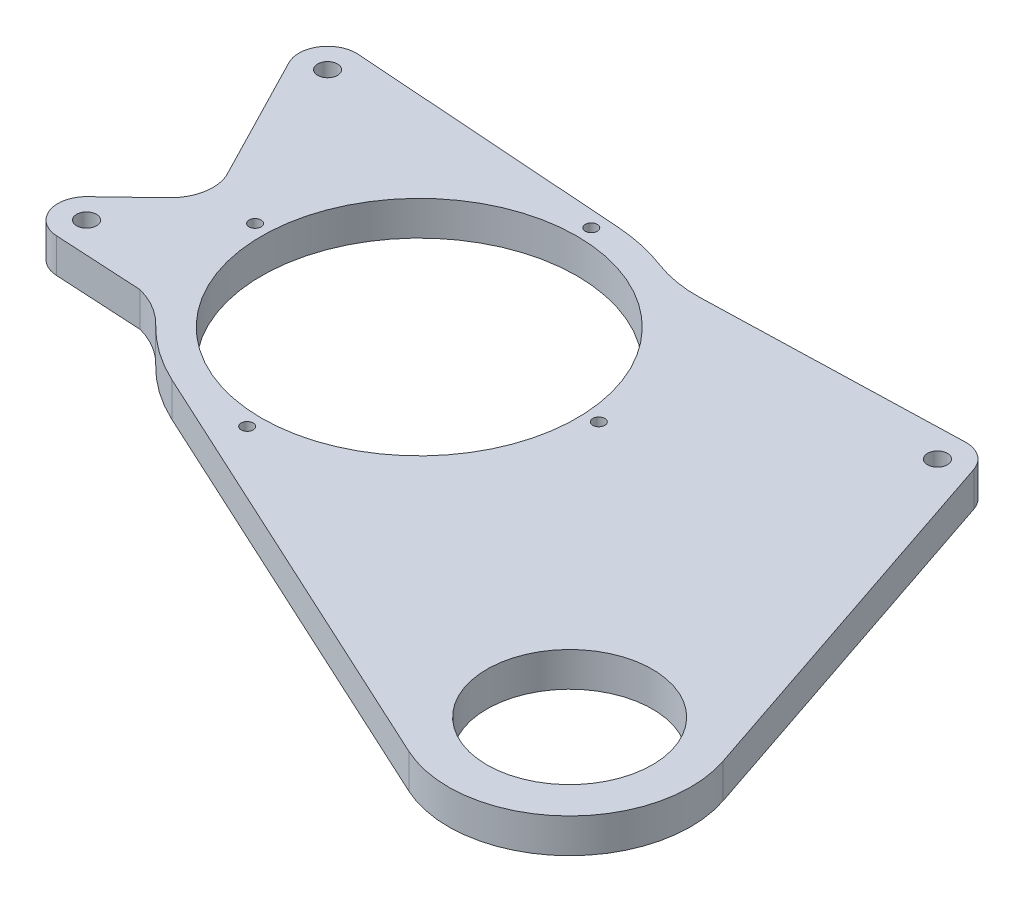
from build123d import *

# Parameters (mm, degrees)
SKETCH1_R           = 3.3
SKETCH1_R_2         = 27.5
SKETCH1_R_3         = 52.3875
SKETCH1_R_4         = 2
BOSS_EXTRUDE1_DEPTH = 11.43


with BuildPart() as part:
    # Sketch1 → Boss-Extrude1 (new body)
    with BuildSketch(Plane(origin=(0, 0, 0), x_dir=(1, 0, 0), z_dir=(0, 1, 0))):
        with BuildLine():
            Line((-455.030211447, -196.569220819), (-601.269315712, -129.028875319))
            ThreePointArc((-601.269315712, -129.028875319), (-611.168375764, -123.292603215), (-619.842929594, -115.832822829))
            ThreePointArc((-619.842929594, -115.832822829), (-625.62049557, -111.271620388), (-632.402453753, -108.409823836))
            Line((-632.402453753, -108.409823836), (-661.891152149, -106.785342117))
            ThreePointArc((-661.891152149, -106.785342117), (-670.303863855, -100.570549133), (-667.940742704, -90.381681261))
            Line((-667.940742704, -90.381681261), (-654.343117313, -77.414452829))
            ThreePointArc((-654.343117313, -77.414452829), (-650.072978561, -70.012815509), (-650.805846426, -61.499224923))
            Line((-650.805846426, -61.499224923), (-673.057822329, -18.34288652))
            ThreePointArc((-673.057822329, -18.34288652), (-672.544957076, -8.73610108), (-663.918846707, -4.476573271))
            Line((-663.918846707, -4.476573271), (-570.934950003, -11.063752399))
            ThreePointArc((-570.934950003, -11.063752399), (-561.986230526, -12.359631359), (-553.321698813, -14.945124108))
            ThreePointArc((-553.321698813, -14.945124108), (-545.349986654, -17.107158275), (-537.109590399, -17.671477372))
            Line((-537.109590399, -17.671477372), (-451.561292182, -15.180486069))
            ThreePointArc((-451.561292182, -15.180486069), (-445.839616936, -16.885847624), (-442.257047488, -21.661936169))
            Line((-442.257047488, -21.661936169), (-399.995822112, -147.172985144))
            ThreePointArc((-399.995822112, -147.172985144), (-411.258692171, -189.980718354), (-455.030211447, -196.569220819))
        make_face()
        with Locations(Location((-661.367230642, -97.274762153, 0), (0, 0, 270))):
            Circle(SKETCH1_R, mode=Mode.SUBTRACT)
        with Locations(Location((-664.591931322, -13.977761728, 0), (0, 0, 270))):
            Circle(SKETCH1_R, mode=Mode.SUBTRACT)
        with Locations(Location((-451.284061184, -24.701450725, 0), (0, 0, 270))):
            Circle(SKETCH1_R, mode=Mode.SUBTRACT)
        with Locations(Location((-438.15, -160.02, 0), (0, 0, 270))):
            Circle(SKETCH1_R_2, mode=Mode.SUBTRACT)
        with Locations(Location((-575.31, -72.821477372, 0), (0, 0, 270))):
            Circle(SKETCH1_R_3, mode=Mode.SUBTRACT)
        with Locations(Location((-632.402453753, -70.257452317, 0), (0, 0, 270))):
            Circle(SKETCH1_R_4, mode=Mode.SUBTRACT)
        with BuildLine():
            ThreePointArc((-575.31, -17.671477372), (-573.31, -15.671477372), (-575.31, -13.671477372))
            ThreePointArc((-575.31, -13.671477372), (-577.31, -15.671477372), (-575.31, -17.671477372))
        make_face(mode=Mode.SUBTRACT)
        with BuildLine():
            ThreePointArc((-518.217546247, -72.257452317), (-516.217546247, -70.257452317), (-518.217546247, -68.257452317))
            ThreePointArc((-518.217546247, -68.257452317), (-520.217546247, -70.257452317), (-518.217546247, -72.257452317))
        make_face(mode=Mode.SUBTRACT)
        with BuildLine():
            ThreePointArc((-575.31, -131.971477372), (-573.31, -129.971477372), (-575.31, -127.971477372))
            ThreePointArc((-575.31, -127.971477372), (-577.31, -129.971477372), (-575.31, -131.971477372))
        make_face(mode=Mode.SUBTRACT)
    extrude(amount=BOSS_EXTRUDE1_DEPTH)


solid = part.part
